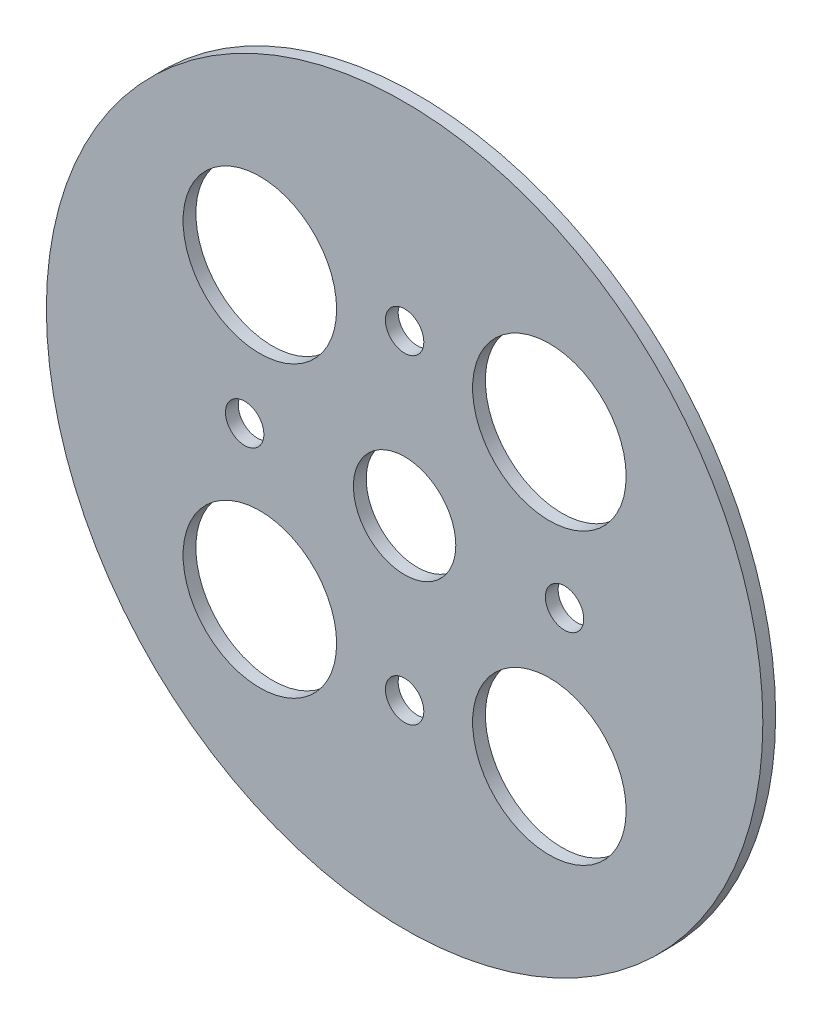
from build123d import *

# Parameters (mm, degrees)
SKETCH_1_R          = 28
EXTRUDE_1_DEPTH     = 1
SKETCH_2_R          = 4
CUT_EXTRUDE_1_DEPTH = 1
CUT_EXTRUDE_2_REACH = 41.611
SKETCH_3_R          = 1.5
CUT_EXTRUDE_3_REACH = 41.611
SKETCH_4_R          = 6


with BuildPart() as part:
    # 草图1 → 凸台-拉伸1 (new body)
    with BuildSketch(Plane.XY):
        Circle(SKETCH_1_R)
    extrude(amount=EXTRUDE_1_DEPTH)

    # 草图2 → 切除-拉伸1 (cut)
    with BuildSketch(Plane.XY.offset(1)):
        Circle(SKETCH_2_R)
    extrude(amount=-CUT_EXTRUDE_1_DEPTH, mode=Mode.SUBTRACT)

    # 草图3 → 切除-拉伸2 (cut, up to next)
    with BuildSketch(Plane.XY.offset(1), mode=Mode.PRIVATE) as cut_extrude_2_sk1:
        with Locations((0, 12.5)):
            Circle(SKETCH_3_R)
    cut_extrude_2_tool1 = extrude(cut_extrude_2_sk1.sketch, amount=-CUT_EXTRUDE_2_REACH, mode=Mode.PRIVATE) & part.part
    # 草图3 → 切除-拉伸2 (cut, up to next)
    with BuildSketch(Plane.XY.offset(1), mode=Mode.PRIVATE) as cut_extrude_2_sk2:
        with Locations((0, -12.5)):
            Circle(SKETCH_3_R)
    cut_extrude_2_tool2 = extrude(cut_extrude_2_sk2.sketch, amount=-CUT_EXTRUDE_2_REACH, mode=Mode.PRIVATE) & part.part
    # 草图3 → 切除-拉伸2 (cut, up to next)
    with BuildSketch(Plane.XY.offset(1), mode=Mode.PRIVATE) as cut_extrude_2_sk3:
        with Locations((12.5, 0)):
            Circle(SKETCH_3_R)
    cut_extrude_2_tool3 = extrude(cut_extrude_2_sk3.sketch, amount=-CUT_EXTRUDE_2_REACH, mode=Mode.PRIVATE) & part.part
    # 草图3 → 切除-拉伸2 (cut, up to next)
    with BuildSketch(Plane.XY.offset(1), mode=Mode.PRIVATE) as cut_extrude_2_sk4:
        with Locations((-12.5, 0)):
            Circle(SKETCH_3_R)
    cut_extrude_2_tool4 = extrude(cut_extrude_2_sk4.sketch, amount=-CUT_EXTRUDE_2_REACH, mode=Mode.PRIVATE) & part.part
    add(cut_extrude_2_tool1.solids().sort_by_distance((0, 12.5, 1))[0], mode=Mode.SUBTRACT)
    add(cut_extrude_2_tool2.solids().sort_by_distance((0, -12.5, 1))[0], mode=Mode.SUBTRACT)
    add(cut_extrude_2_tool3.solids().sort_by_distance((12.5, 0, 1))[0], mode=Mode.SUBTRACT)
    add(cut_extrude_2_tool4.solids().sort_by_distance((-12.5, 0, 1))[0], mode=Mode.SUBTRACT)

    # 草图4 → 切除-拉伸3 (cut, up to next)
    with BuildSketch(Plane.XY.offset(1), mode=Mode.PRIVATE) as cut_extrude_3_sk1:
        with Locations((11.313708499, -11.313708499)):
            Circle(SKETCH_4_R)
    cut_extrude_3_tool1 = extrude(cut_extrude_3_sk1.sketch, amount=-CUT_EXTRUDE_3_REACH, mode=Mode.PRIVATE) & part.part
    # 草图4 → 切除-拉伸3 (cut, up to next)
    with BuildSketch(Plane.XY.offset(1), mode=Mode.PRIVATE) as cut_extrude_3_sk2:
        with Locations((-11.313708499, -11.313708499)):
            Circle(SKETCH_4_R)
    cut_extrude_3_tool2 = extrude(cut_extrude_3_sk2.sketch, amount=-CUT_EXTRUDE_3_REACH, mode=Mode.PRIVATE) & part.part
    # 草图4 → 切除-拉伸3 (cut, up to next)
    with BuildSketch(Plane.XY.offset(1), mode=Mode.PRIVATE) as cut_extrude_3_sk3:
        with Locations((-11.313708499, 11.313708499)):
            Circle(SKETCH_4_R)
    cut_extrude_3_tool3 = extrude(cut_extrude_3_sk3.sketch, amount=-CUT_EXTRUDE_3_REACH, mode=Mode.PRIVATE) & part.part
    # 草图4 → 切除-拉伸3 (cut, up to next)
    with BuildSketch(Plane.XY.offset(1), mode=Mode.PRIVATE) as cut_extrude_3_sk4:
        with Locations((11.313708499, 11.313708499)):
            Circle(SKETCH_4_R)
    cut_extrude_3_tool4 = extrude(cut_extrude_3_sk4.sketch, amount=-CUT_EXTRUDE_3_REACH, mode=Mode.PRIVATE) & part.part
    add(cut_extrude_3_tool1.solids().sort_by_distance((11.313708, -11.313708, 1))[0], mode=Mode.SUBTRACT)
    add(cut_extrude_3_tool2.solids().sort_by_distance((-11.313708, -11.313708, 1))[0], mode=Mode.SUBTRACT)
    add(cut_extrude_3_tool3.solids().sort_by_distance((-11.313708, 11.313708, 1))[0], mode=Mode.SUBTRACT)
    add(cut_extrude_3_tool4.solids().sort_by_distance((11.313708, 11.313708, 1))[0], mode=Mode.SUBTRACT)


solid = part.part
